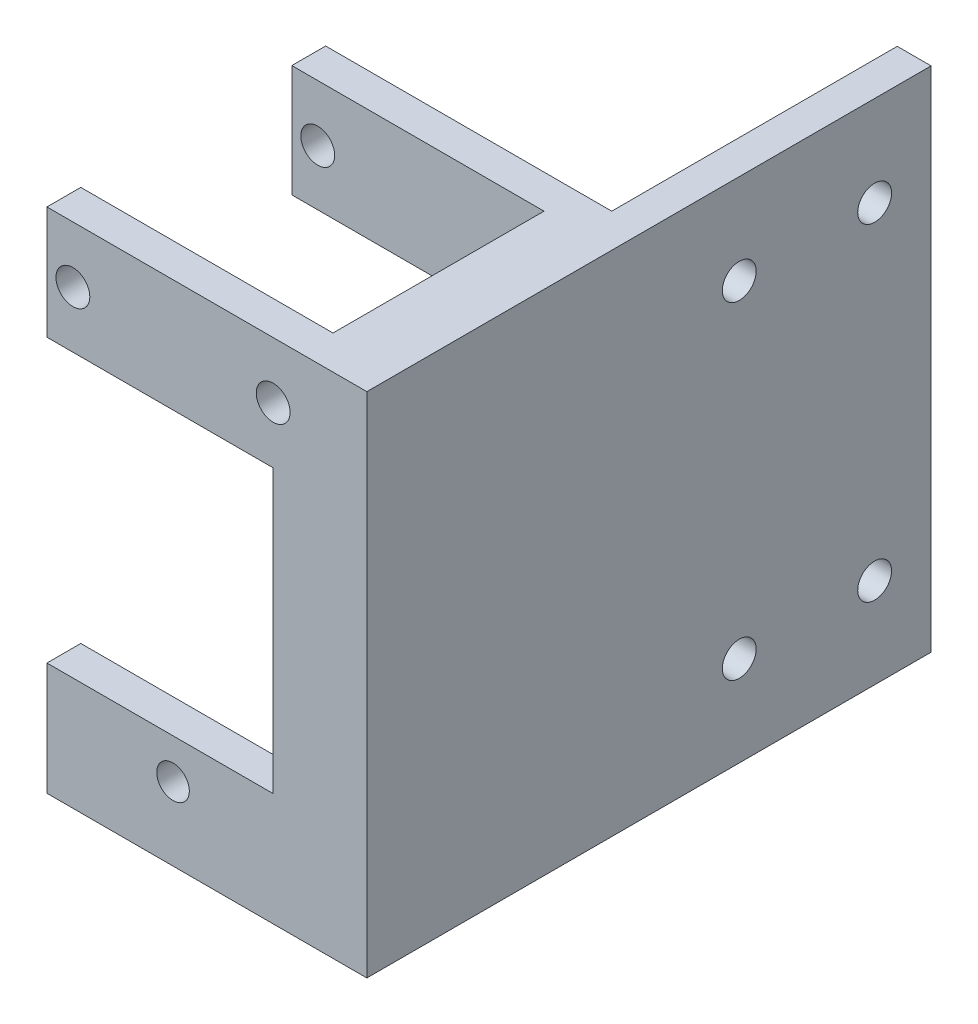
from build123d import *

# Parameters (mm, degrees)
SKETCH2_W           = 5.3
SKETCH2_H           = 25
SKETCH2_R           = 1.5
SKETCH2_R_2         = 1.445
BOSS_EXTRUDE1_DEPTH = 3
SKETCH3_W           = 50
SKETCH3_H           = 45
BOSS_EXTRUDE2_DEPTH = 3
SKETCH7_W           = 38.35
SKETCH7_H           = 3
BOSS_EXTRUDE3_DEPTH = 45
CUT_EXTRUDE1_DEPTH  = 5
SKETCH14_R          = 1.5
SKETCH14_R_2        = 1.45
CUT_EXTRUDE5_DEPTH  = 5
SKETCH15_R          = 1.5
CUT_EXTRUDE6_DEPTH  = 5
SKETCH12_W          = 18.7
SKETCH12_H          = 45
BOSS_EXTRUDE4_DEPTH = 3


with BuildPart() as part:
    # Sketch2 → Boss-Extrude1 (new body)
    # profile 1 of 3: a face of its own
    with BuildSketch(Plane.XY):
        with Locations((10.025, 0)):
            Rectangle(SKETCH2_W, SKETCH2_H)
    # profile 2 of 3: a face of its own
    with BuildSketch(Plane.XY):
        Polygon((7.375, 12.5), (12.675, 12.5), (12.675, 22.5), (-12.675, 22.5), (-12.675, 12.5), align=None)
        with Locations((-10.375, 17.5)):
            Circle(SKETCH2_R, mode=Mode.SUBTRACT)
        with Locations((7.375, 17.5)):
            Circle(SKETCH2_R, mode=Mode.SUBTRACT)
    # profile 3 of 3: a face of its own
    with BuildSketch(Plane.XY):
        Polygon((-12.675, -22.5), (12.675, -22.5), (12.675, -12.5), (7.375, -12.5), (-12.675, -12.5), align=None)
        with Locations((-1.5, -16.025)):
            Circle(SKETCH2_R_2, mode=Mode.SUBTRACT)
    extrude(amount=-BOSS_EXTRUDE1_DEPTH)

    # Sketch3 → Boss-Extrude2 (add)
    with BuildSketch(Plane(origin=(12.675, 0, 0), x_dir=(0, 0, -1), z_dir=(1, 0, 0))):
        with Locations((25, 0)):
            Rectangle(SKETCH3_W, SKETCH3_H)
    extrude(amount=BOSS_EXTRUDE2_DEPTH)

    # Sketch7 → Boss-Extrude3 (add)
    with BuildSketch(Plane(origin=(0, 22.5, 0), x_dir=(1, 0, 0), z_dir=(0, 1, 0))):
        with Locations((-3.5, 23.2)):
            Rectangle(SKETCH7_W, SKETCH7_H)
    extrude(amount=-BOSS_EXTRUDE3_DEPTH)

    # Sketch8 → Cut-Extrude1 (cut)
    with BuildSketch(Plane.XY.offset(-21.7)):
        Polygon((-12.675, 12.572802409), (-12.675, 22.5), (-22.675, 22.5), (-22.675, -22.5), (-12.675, -22.5), (-12.675, -12.5), (7.375, -12.5), (7.375, 12.572802409), align=None)
    extrude(amount=-CUT_EXTRUDE1_DEPTH, mode=Mode.SUBTRACT)

    # Sketch14 → Cut-Extrude5 (cut)
    with BuildSketch(Plane.XY.offset(-21.7)):
        with Locations((-10.375, 17.5)):
            Circle(SKETCH14_R)
        with Locations((7.375, 17.5)):
            Circle(SKETCH14_R)
        with Locations((-1.5, -16.025)):
            Circle(SKETCH14_R_2)
    extrude(amount=-CUT_EXTRUDE5_DEPTH, mode=Mode.SUBTRACT)

    # Sketch15 → Cut-Extrude6 (cut)
    with BuildSketch(Plane.ZY.offset(-12.675)):
        with Locations((-33, 14.5)):
            Circle(SKETCH15_R)
        with Locations((-33, -14.5)):
            Circle(SKETCH15_R)
        with Locations((-45, 14.5)):
            Circle(SKETCH15_R)
        with Locations((-45, -14.5)):
            Circle(SKETCH15_R)
    extrude(amount=-CUT_EXTRUDE6_DEPTH, mode=Mode.SUBTRACT)

    # Sketch12 → Boss-Extrude4 (add)
    with BuildSketch(Plane.ZY.offset(-12.675)):
        with Locations((-12.35, 0)):
            Rectangle(SKETCH12_W, SKETCH12_H)
    extrude(amount=BOSS_EXTRUDE4_DEPTH)


solid = part.part
